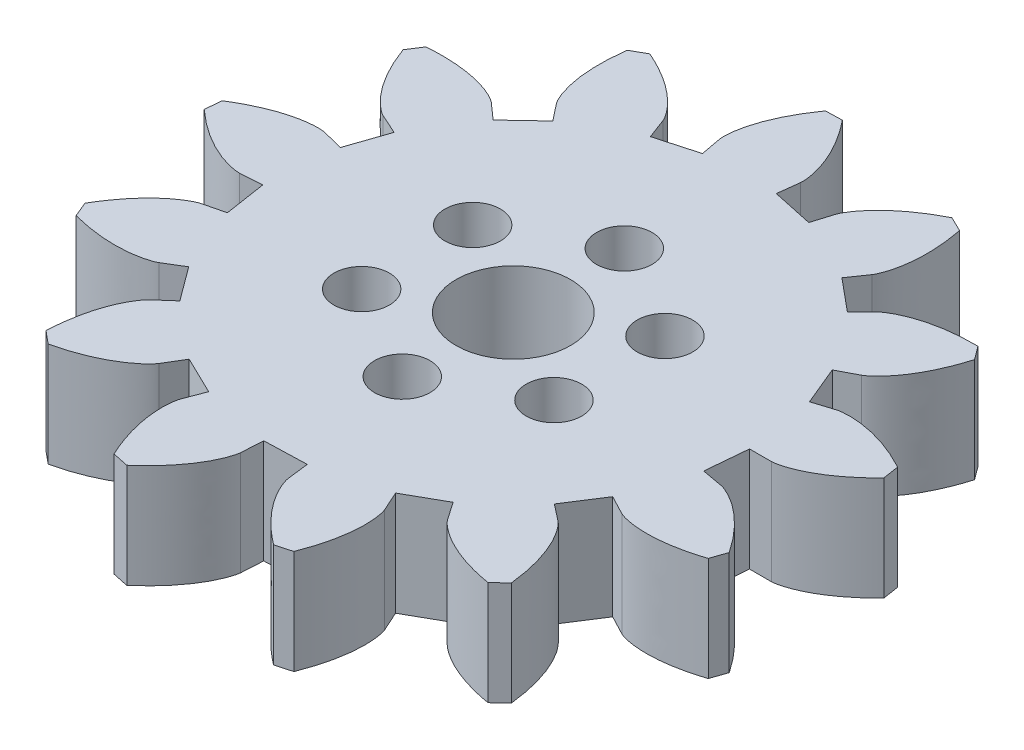
from build123d import *

# Parameters (mm, degrees)
BOSS_EXTRUDE1_DEPTH = 1.5
CIRPATTERN1_COUNT   = 13
SKETCH3_R           = 0.8
SKETCH3_R_2         = 1.65
CUT_EXTRUDE1_DEPTH  = 14.816151508


with BuildPart() as part:
    # Sketch4 → Boss-Extrude1 (new, symmetric)
    with BuildSketch(Plane(origin=(0, 0, 0), x_dir=(1, 0, 0), z_dir=(0, 1, 0))):
        with BuildLine():
            Line((0, 0), (6.263275645, 2.602750232))
            Line((6.263275645, 2.602750232), (6.496786874, 2.040833527))
            Line((6.496786874, 2.040833527), (7.095523768, 2.228900768))
            add(Edge.make_bspline(
                [(7.095523768, 2.228900768), (7.241865653, 2.274867728), (8.101851863, 2.383646686), (9.397063968, 1.682132101)],
                knots=[0, 0, 0, 0, 1, 1, 1, 1], degree=3))
            Line((9.397063968, 1.682132101), (9.433162207, 1.44676802))
            Line((9.433162207, 1.44676802), (9.469259758, 1.211403835))
            add(Edge.make_bspline(
                [(7.437368902, 1.5039e-05), (7.59076026, 1.8292e-05), (8.443818359, 0.153969654), (9.469259758, 1.211403835)],
                knots=[0, 0, 0, 0, 1, 1, 1, 1], degree=3))
            Line((7.437368902, 1.5039e-05), (6.809790098, 1.731e-06))
            Line((6.809790098, 1.731e-06), (6.755413504, -0.606068449))
            Line((6.755413504, -0.606068449), (0, 0))
        make_face()
    boss_extrude1 = extrude(amount=BOSS_EXTRUDE1_DEPTH, both=True)

    # CirPattern1: Boss-Extrude1 ×13 about axis
    cirpattern1_axis = Axis((0, -1.5, 0), (0, 1, 0))
    for i in range(1, CIRPATTERN1_COUNT):
        add(boss_extrude1.rotate(cirpattern1_axis, i * 360 / CIRPATTERN1_COUNT))

    # Sketch3 → Cut-Extrude1 (cut, through all)
    with BuildSketch(Plane(origin=(0, 1.5, 0), x_dir=(1, 0, 0), z_dir=(0, 1, 0))):
        with Locations((-2.771281292, -1.6)):
            Circle(SKETCH3_R)
        with Locations((0, -3.2)):
            Circle(SKETCH3_R)
        with Locations((2.771281292, -1.6)):
            Circle(SKETCH3_R)
        with Locations((2.771281292, 1.6)):
            Circle(SKETCH3_R)
        with Locations((0, 3.2)):
            Circle(SKETCH3_R)
        with Locations((-2.771281292, 1.6)):
            Circle(SKETCH3_R)
        Circle(SKETCH3_R_2)
    extrude(amount=-CUT_EXTRUDE1_DEPTH, mode=Mode.SUBTRACT)


solid = part.part
